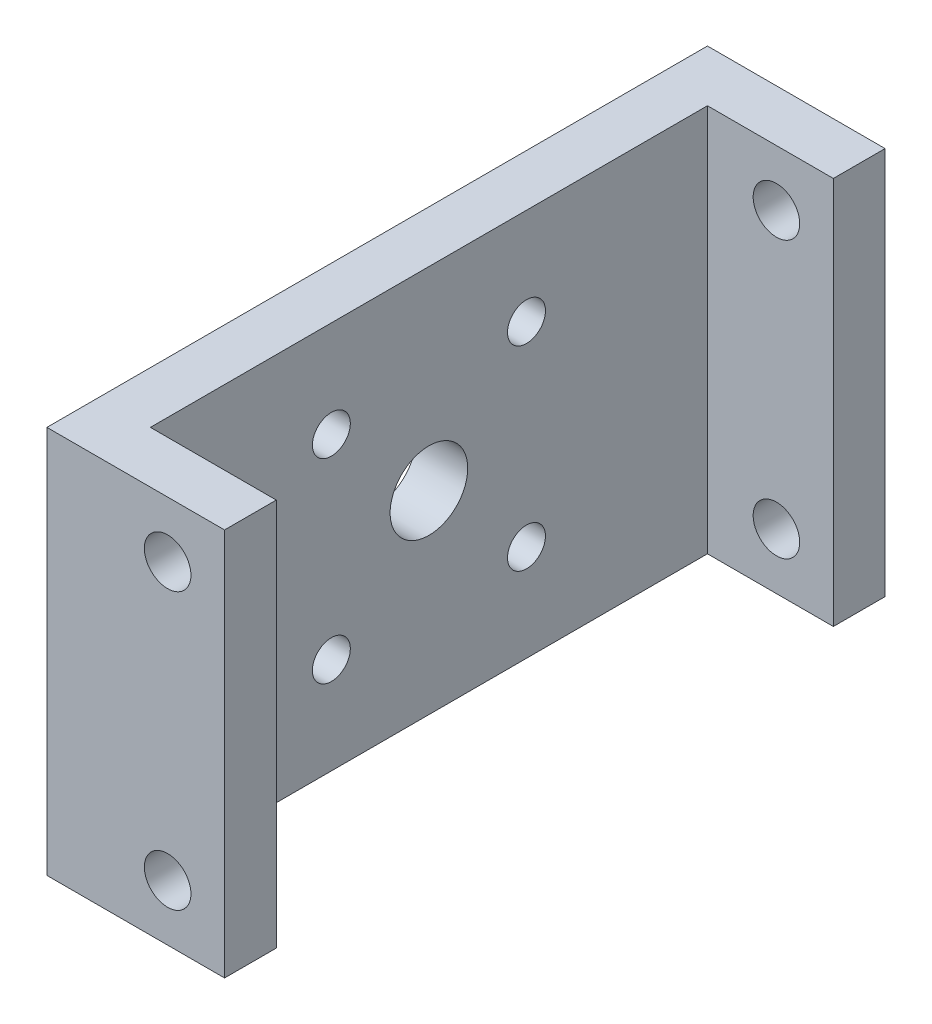
from build123d import *

# Parameters (mm, degrees)
SKETCH1_W           = 32.3
SKETCH1_H           = 22.5
SKETCH1_R           = 1.1
SKETCH1_R_2         = 2.25
BOSS_EXTRUDE1_DEPTH = 3
SKETCH1_5_W         = 3
SKETCH1_5_H         = 22.5
BOSS_EXTRUDE5_DEPTH = 10.3
CUT_EXTRUDE1_REACH  = 43.226
SKETCH2_R           = 1.35


with BuildPart() as part:
    # Sketch1 → Boss-Extrude1 (new body)
    with BuildSketch(Plane(origin=(0, 0, 0), x_dir=(0, 0, -1), z_dir=(1, 0, 0))):
        Rectangle(SKETCH1_W, SKETCH1_H)
        with Locations((-5.656854249, -5.656854249)):
            Circle(SKETCH1_R, mode=Mode.SUBTRACT)
        with Locations((5.656854249, -5.656854249)):
            Circle(SKETCH1_R, mode=Mode.SUBTRACT)
        Circle(SKETCH1_R_2, mode=Mode.SUBTRACT)
        with Locations((-5.656854249, 5.656854249)):
            Circle(SKETCH1_R, mode=Mode.SUBTRACT)
        with Locations((5.656854249, 5.656854249)):
            Circle(SKETCH1_R, mode=Mode.SUBTRACT)
    extrude(amount=BOSS_EXTRUDE1_DEPTH)

    # Sketch1<5> → Boss-Extrude5 (add)
    with BuildSketch(Plane(origin=(0, 0, 0), x_dir=(0, 0, -1), z_dir=(1, 0, 0))):
        with Locations((17.65, 0)):
            Rectangle(SKETCH1_5_W, SKETCH1_5_H)
        with Locations((-17.65, 0)):
            Rectangle(SKETCH1_5_W, SKETCH1_5_H)
    extrude(amount=BOSS_EXTRUDE5_DEPTH)

    # Cut-Extrude1: up to this face of the body (flat: up to its plane)
    cut_extrude1_end = Plane(part.part.faces().sort_by_distance((5.15, 0, -19.15))[0])
    # Sketch2 → Cut-Extrude1 (cut, up to the picked face)
    with BuildSketch(Plane.XY.offset(19.15), mode=Mode.PRIVATE) as cut_extrude1_sk1:
        with Locations((7, 8)):
            Circle(SKETCH2_R)
    cut_extrude1_tool1 = split(extrude(cut_extrude1_sk1.sketch, amount=-CUT_EXTRUDE1_REACH, mode=Mode.PRIVATE), bisect_by=cut_extrude1_end, keep=Keep.BOTH, mode=Mode.PRIVATE)
    cut_extrude1 = cut_extrude1_tool1.solids().sort_by(Axis((7, 8, 19.15), (0, 0, -1)))[0]
    add(cut_extrude1, mode=Mode.SUBTRACT)

    # Mirror1: Cut-Extrude1 across plane
    add(cut_extrude1.mirror(Plane.ZX), mode=Mode.SUBTRACT)


solid = part.part
